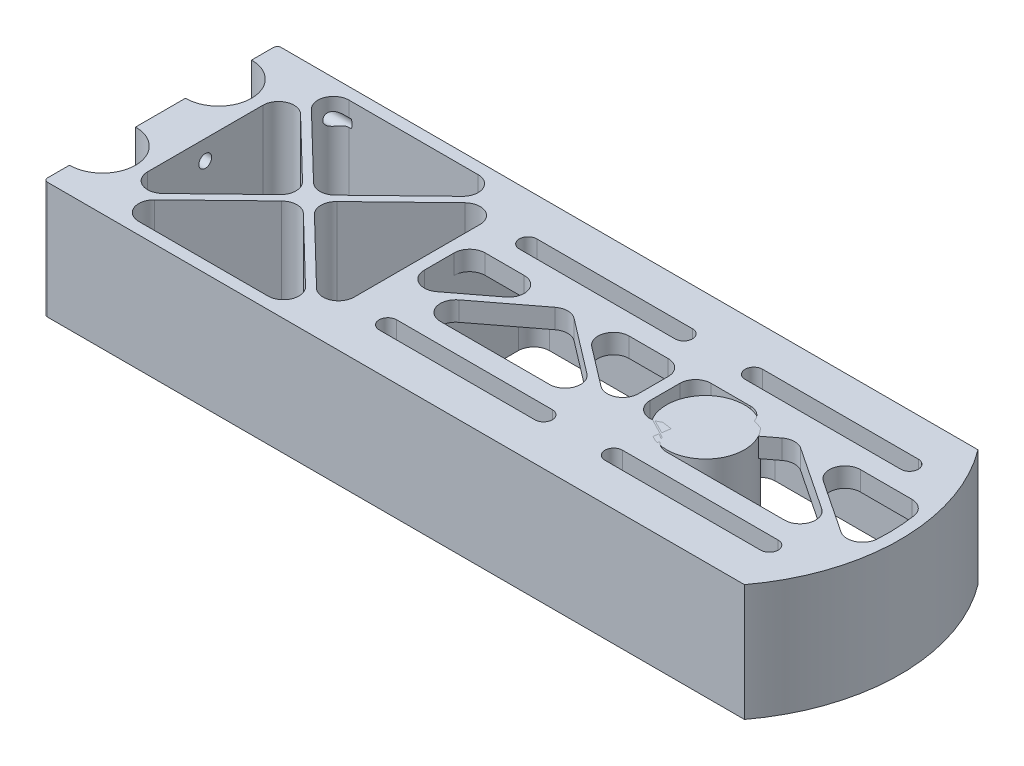
from build123d import *

# Parameters (mm, degrees)
EXTRUDE_1_DEPTH      = 30
CUT_EXTRUDE_1_DEPTH  = 202.494416796
TEMP_R               = 10
EXTRUDE_2_DEPTH      = 30
EXTRUDE_3_DEPTH      = 5
EXTRUDE_4_DEPTH      = 30
SKETCH_6_W           = 3
SKETCH_6_H           = 54
EXTRUDE_5_DEPTH      = 30
EXTRUDE_6_DEPTH      = 30
EXTRUDE_8_DEPTH      = 25
EXTRUDE_8_DEPTH_BACK = 5
SKETCH_9_W           = 3
SKETCH_9_H           = 54
EXTRUDE_7_DEPTH      = 5
FILLET_1_R           = 4
FILLET_2_R           = 4
FILLET_3_R           = 4
EXTRUDE_9_DEPTH      = 5
CUT_EXTRUDE_4_DEPTH  = 202.494416796
EXTRUDE_10_DEPTH     = 30
FILLET_4_R           = 4
M4X0_71_AT_2_COUNT   = 2
M4X0_71_AT_2_PITCH   = 25.75
M4X0_71_AT_3_COUNT   = 2
M4X0_71_AT_3_PITCH   = 51.5
M4X0_71_AT_4_COUNT   = 2
M4X0_71_AT_4_PITCH   = 55.247171873
M4X0_71_AT_5_COUNT   = 2
M4X0_71_AT_5_PITCH   = 32.60463924
M4X0_71_AT_6_COUNT   = 2
M4X0_71_AT_6_PITCH   = 20
FILLET_5_R           = 1


with BuildPart() as part:
    # Эскиз1 → Бобышка-Вытянуть1 (new body)
    with BuildSketch(Plane(origin=(0, 0, 0), x_dir=(1, 0, 0), z_dir=(0, 1, 0))):
        with BuildLine():
            Line((0, 60), (180, 60))
            ThreePointArc((180, 60), (190, 30), (180, 0))
            Line((180, 0), (0, 0))
            Line((0, 0), (0, 8))
            ThreePointArc((0, 8), (7.1, 15.1), (0, 22.2))
            Line((0, 22.2), (0, 37.8))
            ThreePointArc((0, 37.8), (7.1, 44.9), (0, 52))
            Line((0, 52), (0, 60))
        make_face()
    extrude(amount=EXTRUDE_1_DEPTH)

    # Эскиз2 → Вырез-Вытянуть1 (cut, through all)
    with BuildSketch(Plane(origin=(0, 30, 0), x_dir=(1, 0, 0), z_dir=(0, 1, 0))):
        with BuildLine():
            Line((3, 3), (178.470768123, 3))
            ThreePointArc((178.470768123, 3), (187, 30), (178.470768123, 57))
            Line((178.470768123, 57), (3, 57))
            Line((3, 57), (3, 54.544169223))
            ThreePointArc((3, 54.544169223), (10.1, 44.9), (3, 35.255830777))
            Line((3, 35.255830777), (3, 24.744169223))
            ThreePointArc((3, 24.744169223), (10.1, 15.1), (3, 5.455830777))
            Line((3, 5.455830777), (3, 3))
        make_face()
    extrude(amount=-CUT_EXTRUDE_1_DEPTH, mode=Mode.SUBTRACT)

    # Эскиз3 → Бобышка-Вытянуть3 (add)
    # profile 1 of 2: a face of its own
    with BuildSketch(Plane(origin=(0, 30, 0), x_dir=(1, 0, 0), z_dir=(0, 1, 0))):
        with BuildLine():
            Line((178.470768123, 57), (68.916586692, 57))
            Line((68.916586692, 57), (68.916586692, 40.5))
            Line((68.916586692, 40.5), (185.812116301, 40.5))
            ThreePointArc((185.812116301, 40.5), (182.941397878, 49.105924428), (178.470768123, 57))
        make_face()
        with BuildLine():
            Line((116.416586692, 43.5), (76.416586692, 43.5))
            ThreePointArc((76.416586692, 43.5), (71.916586692, 48), (76.416586692, 52.5))
            Line((76.416586692, 52.5), (116.416586692, 52.5))
            ThreePointArc((116.416586692, 52.5), (120.916586692, 48), (116.416586692, 43.5))
        make_face(mode=Mode.SUBTRACT)
        with BuildLine():
            ThreePointArc((174.416586692, 52.5), (178.916586692, 48), (174.416586692, 43.5))
            Line((174.416586692, 43.5), (134.416586692, 43.5))
            ThreePointArc((134.416586692, 43.5), (129.916586692, 48), (134.416586692, 52.5))
            Line((134.416586692, 52.5), (174.416586692, 52.5))
        make_face(mode=Mode.SUBTRACT)
    # profile 2 of 2: a face of its own
    with BuildSketch(Plane(origin=(0, 30, 0), x_dir=(1, 0, 0), z_dir=(0, 1, 0))):
        with BuildLine():
            ThreePointArc((178.470768123, 3), (182.941397878, 10.894075572), (185.812116301, 19.5))
            Line((185.812116301, 19.5), (68.916586692, 19.5))
            Line((68.916586692, 19.5), (68.916586692, 3))
            Line((68.916586692, 3), (178.470768123, 3))
        make_face()
        with BuildLine():
            ThreePointArc((76.416586692, 7.5), (71.916586692, 12), (76.416586692, 16.5))
            Line((76.416586692, 16.5), (116.416586692, 16.5))
            ThreePointArc((116.416586692, 16.5), (120.916586692, 12), (116.416586692, 7.5))
            Line((116.416586692, 7.5), (76.416586692, 7.5))
        make_face(mode=Mode.SUBTRACT)
        with BuildLine():
            Line((134.416586692, 16.5), (174.416586692, 16.5))
            ThreePointArc((174.416586692, 16.5), (178.916586692, 12), (174.416586692, 7.5))
            Line((174.416586692, 7.5), (134.416586692, 7.5))
            ThreePointArc((134.416586692, 7.5), (129.916586692, 12), (134.416586692, 16.5))
        make_face(mode=Mode.SUBTRACT)
    extrude(amount=-EXTRUDE_3_DEPTH)

    # Эскиз4 → Бобышка-Вытянуть4 (add, through all)
    with BuildSketch(Plane(origin=(0, 30, 0), x_dir=(1, 0, 0), z_dir=(0, 1, 0))):
        with BuildLine():
            Line((10.1, 57), (3, 57))
            Line((3, 57), (3, 54.544169223))
            ThreePointArc((3, 54.544169223), (8.133572401, 50.887904475), (10.1, 44.9))
            Line((10.1, 44.9), (10.1, 57))
        make_face()
        with BuildLine():
            Line((10.1, 15.099999916), (10.1, 44.9))
            ThreePointArc((10.1, 44.9), (8.133572401, 38.912095525), (3, 35.255830777))
            Line((3, 35.255830777), (3, 24.744169223))
            ThreePointArc((3, 24.744169223), (8.133572426, 21.087904441), (10.1, 15.099999916))
        make_face()
        with BuildLine():
            Line((10.1, 3), (10.1, 15.099999916))
            ThreePointArc((10.1, 15.099999916), (8.133572376, 9.112095491), (3, 5.455830777))
            Line((3, 5.455830777), (3, 3))
            Line((3, 3), (10.1, 3))
        make_face()
    extrude(amount=-EXTRUDE_4_DEPTH)

    # Эскиз6 → Бобышка-Вытянуть5 (add, through all)
    with BuildSketch(Plane(origin=(0, 30, 0), x_dir=(1, 0, 0), z_dir=(0, 1, 0))):
        with Locations((67.416586692, 30)):
            Rectangle(SKETCH_6_W, SKETCH_6_H)
    extrude(amount=-EXTRUDE_5_DEPTH)

    # Эскиз7 → Бобышка-Вытянуть6 (add, through all)
    with BuildSketch(Plane(origin=(0, 30, 0), x_dir=(1, 0, 0), z_dir=(0, 1, 0))):
        Polygon((10.1, 55.608609353), (36.57009563, 30), (10.1, 4.391390647), (10.1, 3), (11.538197716, 3), (38.008293346, 28.608609353), (64.478388976, 3), (65.916586692, 3), (65.916586692, 4.391390647), (39.446491062, 30), (65.916586692, 55.608609353), (65.916586692, 57), (64.478388976, 57), (38.008293346, 31.391390647), (11.538197716, 57), (10.1, 57), align=None)
    extrude(amount=-EXTRUDE_6_DEPTH)

    # Эскиз9 → Бобышка-Вытянуть8 (add, two sides: drawn at the far end of the back side and taken through both)
    with BuildSketch(Plane.XZ.offset(-25).offset(-EXTRUDE_8_DEPTH_BACK)):
        with Locations((125.416586692, -30)):
            Rectangle(SKETCH_9_W, SKETCH_9_H)
    extrude(amount=EXTRUDE_8_DEPTH + EXTRUDE_8_DEPTH_BACK)

    # Эскиз8 → Бобышка-Вытянуть7 (add)
    with BuildSketch(Plane(origin=(0, 30, 0), x_dir=(1, 0, 0), z_dir=(0, 1, 0))):
        Polygon((70.564267671, 19.5), (96.416586692, 39.241770889), (122.268905713, 19.5), (123.916586692, 19.5), (123.916586692, 20.758229111), (98.064267671, 40.5), (94.768905713, 40.5), (68.916586692, 20.758229111), (68.916586692, 19.5), align=None)
        with BuildLine():
            Line((128.569887735, 19.5), (154.477979009, 39.178204914))
            Line((154.477979009, 39.178204914), (184.008770478, 19.5))
            Line((184.008770478, 19.5), (185.812116301, 19.5))
            ThreePointArc((185.812116301, 19.5), (185.929117822, 20.024222532), (186.040120933, 20.549747915))
            Line((186.040120933, 20.549747915), (156.101072293, 40.5))
            Line((156.101072293, 40.5), (152.911636662, 40.5))
            Line((152.911636662, 40.5), (126.916586692, 20.755746568))
            Line((126.916586692, 20.755746568), (126.916586692, 19.5))
            Line((126.916586692, 19.5), (128.569887735, 19.5))
        make_face()
    extrude(amount=-EXTRUDE_7_DEPTH)

    # Скругление1
    fillet_1_edges = [part.edges().sort_by_distance(p)[0] for p in [
        (36.57009563, 15, -30),
        (11.538197716, 15, -57),
        (38.008293346, 15, -31.391390647),
        (64.478388976, 15, -57),
        (65.916586692, 15, -55.608609353),
        (39.446491062, 15, -30),
        (65.916586692, 15, -4.391390647),
        (64.478388976, 15, -3),
        (38.008293346, 15, -28.608609353),
        (11.538197716, 15, -3),
    ]]
    fillet(fillet_1_edges, radius=FILLET_1_R)

    # Скругление2
    fillet_2_edges = [part.edges().sort_by_distance(p)[0] for p in [
        (68.916586692, 12.5, -57),
        (68.916586692, 12.5, -3),
        (123.916586692, 12.5, -57),
        (126.916586692, 12.5, -3),
        (123.916586692, 12.5, -3),
        (126.916586692, 12.5, -57),
        (178.470768123, 12.5, -57),
        (178.470768123, 12.5, -3),
    ]]
    fillet(fillet_2_edges, radius=FILLET_2_R)

    # Скругление3
    fillet_3_edges = [part.edges().sort_by_distance(p)[0] for p in [
        (123.916586692, 27.5, -40.5),
        (126.916586692, 27.5, -40.5),
        (70.564267671, 27.5, -19.5),
        (68.916586692, 27.5, -20.758229111),
        (94.768905713, 27.5, -40.5),
        (98.064267671, 27.5, -40.5),
        (123.916586692, 27.5, -20.758229111),
        (122.268905713, 27.5, -19.5),
        (96.416586692, 27.5, -39.241770889),
        (128.569887735, 27.5, -19.5),
        (126.916586692, 27.5, -20.755746568),
        (152.911636662, 27.5, -40.5),
        (156.101072293, 27.5, -40.5),
        (186.040120933, 27.5, -20.549747915),
        (184.008770478, 27.5, -19.5),
        (154.477979009, 27.5, -39.178204914),
        (68.916586692, 27.5, -40.5),
        (185.812116301, 27.5, -40.5),
    ]]
    fillet(fillet_3_edges, radius=FILLET_3_R)

    # Эскиз10 → Бобышка-Вытянуть9 (add)
    # profile 1 of 4: a face of its own
    with BuildSketch(Plane(origin=(0, 30, 0), x_dir=(1, 0, 0), z_dir=(0, 1, 0))):
        with BuildLine():
            Line((76.416586692, 52.5), (116.416586692, 52.5))
            ThreePointArc((116.416586692, 52.5), (120.916586692, 48), (116.416586692, 43.5))
            Line((116.416586692, 43.5), (76.416586692, 43.5))
            ThreePointArc((76.416586692, 43.5), (71.916586692, 48), (76.416586692, 52.5))
        make_face()
        with BuildLine():
            Line((116.416586692, 50.25), (76.416586692, 50.25))
            ThreePointArc((76.416586692, 50.25), (74.166586692, 48), (76.416586692, 45.75))
            Line((76.416586692, 45.75), (116.416586692, 45.75))
            ThreePointArc((116.416586692, 45.75), (118.666586692, 48), (116.416586692, 50.25))
        make_face(mode=Mode.SUBTRACT)
    # profile 2 of 4: a face of its own
    with BuildSketch(Plane(origin=(0, 30, 0), x_dir=(1, 0, 0), z_dir=(0, 1, 0))):
        with BuildLine():
            Line((174.416586692, 52.5), (134.416586692, 52.5))
            ThreePointArc((134.416586692, 52.5), (129.916586692, 48), (134.416586692, 43.5))
            Line((134.416586692, 43.5), (174.416586692, 43.5))
            ThreePointArc((174.416586692, 43.5), (178.916586692, 48), (174.416586692, 52.5))
        make_face()
        with BuildLine():
            Line((174.416586692, 45.75), (134.416586692, 45.75))
            ThreePointArc((134.416586692, 45.75), (132.166586692, 48), (134.416586692, 50.25))
            Line((134.416586692, 50.25), (174.416586692, 50.25))
            ThreePointArc((174.416586692, 50.25), (176.666586692, 48), (174.416586692, 45.75))
        make_face(mode=Mode.SUBTRACT)
    # profile 3 of 4: a face of its own
    with BuildSketch(Plane(origin=(0, 30, 0), x_dir=(1, 0, 0), z_dir=(0, 1, 0))):
        with BuildLine():
            Line((76.416586692, 16.5), (116.416586692, 16.5))
            ThreePointArc((116.416586692, 16.5), (120.916586692, 12), (116.416586692, 7.5))
            Line((116.416586692, 7.5), (76.416586692, 7.5))
            ThreePointArc((76.416586692, 7.5), (71.916586692, 12), (76.416586692, 16.5))
        make_face()
        with BuildLine():
            Line((76.416586692, 9.75), (116.416586692, 9.75))
            ThreePointArc((116.416586692, 9.75), (118.666586692, 12), (116.416586692, 14.25))
            Line((116.416586692, 14.25), (76.416586692, 14.25))
            ThreePointArc((76.416586692, 14.25), (74.166586692, 12), (76.416586692, 9.75))
        make_face(mode=Mode.SUBTRACT)
    # profile 4 of 4: a face of its own
    with BuildSketch(Plane(origin=(0, 30, 0), x_dir=(1, 0, 0), z_dir=(0, 1, 0))):
        with BuildLine():
            Line((174.416586692, 16.5), (134.416586692, 16.5))
            ThreePointArc((134.416586692, 16.5), (129.916586692, 12), (134.416586692, 7.5))
            Line((134.416586692, 7.5), (174.416586692, 7.5))
            ThreePointArc((174.416586692, 7.5), (178.916586692, 12), (174.416586692, 16.5))
        make_face()
        with BuildLine():
            Line((174.416586692, 14.25), (134.416586692, 14.25))
            ThreePointArc((134.416586692, 14.25), (132.166586692, 12), (134.416586692, 9.75))
            Line((134.416586692, 9.75), (174.416586692, 9.75))
            ThreePointArc((174.416586692, 9.75), (176.666586692, 12), (174.416586692, 14.25))
        make_face(mode=Mode.SUBTRACT)
    extrude(amount=-EXTRUDE_9_DEPTH)

    # Эскиз16 → Вырез-Вытянуть4 (cut, through all)
    with BuildSketch(Plane(origin=(0, 30, 0), x_dir=(1, 0, 0), z_dir=(0, 1, 0))):
        with BuildLine():
            Line((0, 8), (0, 6.6))
            ThreePointArc((0, 6.6), (8.5, 15.1), (0, 23.6))
            Line((0, 23.6), (0, 22.2))
            ThreePointArc((0, 22.2), (7.1, 15.1), (0, 8))
        make_face()
        with BuildLine():
            Line((0, 37.8), (0, 36.4))
            ThreePointArc((0, 36.4), (8.5, 44.9), (0, 53.4))
            Line((0, 53.4), (0, 52))
            ThreePointArc((0, 52), (7.1, 44.9), (0, 37.8))
        make_face()
    extrude(amount=-CUT_EXTRUDE_4_DEPTH, mode=Mode.SUBTRACT)

    # Эскиз17 → Бобышка-Вытянуть10 (add, through all)
    with BuildSketch(Plane(origin=(0, 30, 0), x_dir=(1, 0, 0), z_dir=(0, 1, 0))):
        Polygon((11.5, 54.254173253), (11.5, 5.745826747), (10.1, 4.391390647), (10.1, 55.608609353), align=None)
    extrude(amount=-EXTRUDE_10_DEPTH)

    # Скругление4
    fillet_4_edges = [part.edges().sort_by_distance(p)[0] for p in [
        (11.5, 15, -54.254173253),
        (11.5, 15, -5.745826747),
    ]]
    fillet(fillet_4_edges, radius=FILLET_4_R)

    # Эскиз14 → Отверстие обработанное метчиком M4x0.71 (revolve, cut)
    with BuildSketch(Plane(origin=(0, 25, -55.75), x_dir=(0, 0, 1), z_dir=(0, 1, 0))):
        Polygon((0, 0), (0, 22.991420021), (1.65, 22), (1.65, 0), align=None)
    m4x0_71 = revolve(axis=Axis((-6.35, 25, -55.75), (1, 0, 0)), mode=Mode.SUBTRACT)

    # Отверстие обработанное метчиком M4x0.71 at 2: Отверстие обработанное метчиком M4x0.71 ×2
    with Locations(*[(0, 0, i * M4X0_71_AT_2_PITCH) for i in range(1, M4X0_71_AT_2_COUNT)]):
        add(m4x0_71, mode=Mode.SUBTRACT)

    # Отверстие обработанное метчиком M4x0.71 at 3: Отверстие обработанное метчиком M4x0.71 ×2
    with Locations(*[(0, 0, i * M4X0_71_AT_3_PITCH) for i in range(1, M4X0_71_AT_3_COUNT)]):
        add(m4x0_71, mode=Mode.SUBTRACT)

    # Отверстие обработанное метчиком M4x0.71 at 4: Отверстие обработанное метчиком M4x0.71 ×2
    with Locations(*[Vector(0, -0.3620094806999335, 0.9321744128023277) * (i * M4X0_71_AT_4_PITCH) for i in range(1, M4X0_71_AT_4_COUNT)]):
        add(m4x0_71, mode=Mode.SUBTRACT)

    # Отверстие обработанное метчиком M4x0.71 at 5: Отверстие обработанное метчиком M4x0.71 ×2
    with Locations(*[Vector(0, -0.6134096394229255, 0.7897649107570155) * (i * M4X0_71_AT_5_PITCH) for i in range(1, M4X0_71_AT_5_COUNT)]):
        add(m4x0_71, mode=Mode.SUBTRACT)

    # Отверстие обработанное метчиком M4x0.71 at 6: Отверстие обработанное метчиком M4x0.71 ×2
    with Locations(*[(0, -i * M4X0_71_AT_6_PITCH, 0) for i in range(1, M4X0_71_AT_6_COUNT)]):
        add(m4x0_71, mode=Mode.SUBTRACT)

    # Скругление5
    fillet_5_edges = [part.edges().sort_by_distance(p)[0] for p in [
        (0, 15, 0),
        (0, 15, -60),
    ]]
    fillet(fillet_5_edges, radius=FILLET_5_R)


with BuildPart() as body_2:
    # Temp → Бобышка-Вытянуть2 (new body)
    with BuildSketch(Plane(origin=(0, 30, 0), x_dir=(1, 0, 0), z_dir=(0, 1, 0))):
        with Locations(Location((140, 30, 0), (0, 0, 270))):
            Circle(TEMP_R)
    extrude(amount=-EXTRUDE_2_DEPTH)


solid = Compound([part.part, body_2.part])
